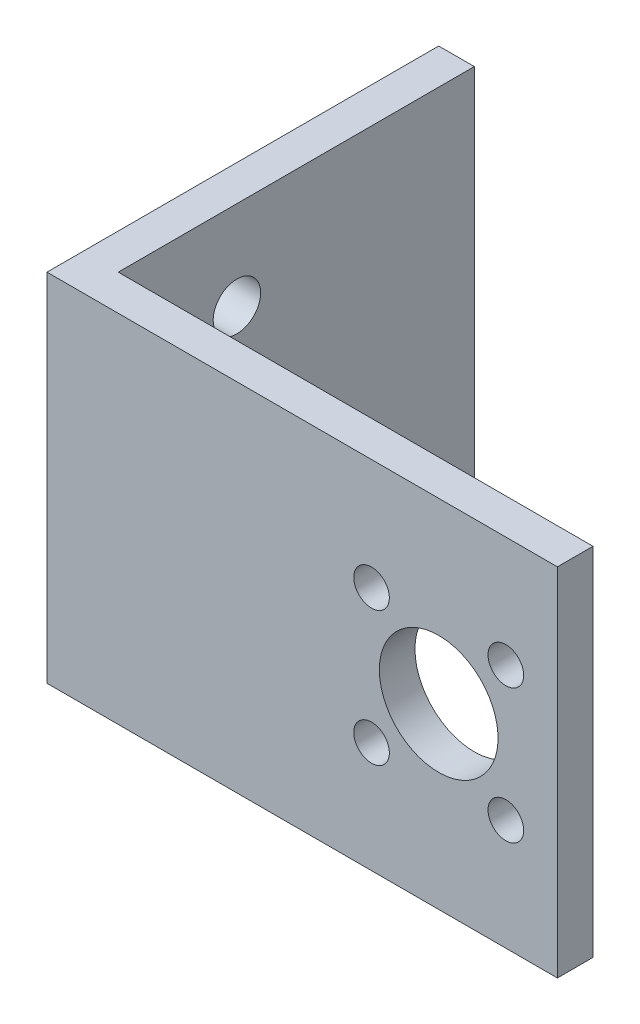
from build123d import *

# Parameters (mm, degrees)
EXTRUDE_1_DEPTH     = 30
CUT_EXTRUDE_1_REACH = 63.952
SKETCH_4_R          = 2
CUT_EXTRUDE_2_REACH = 62.407
SKETCH_5_R          = 5
SKETCH_5_R_2        = 1.5


with BuildPart() as part:
    # 草图2 → 凸台-拉伸1 (new body)
    with BuildSketch(Plane(origin=(0, 0, 0), x_dir=(1, 0, 0), z_dir=(0, 1, 0))):
        Polygon((0, 0), (43, 0), (43, 3), (3, 3), (3, 33), (0, 33), align=None)
    extrude(amount=EXTRUDE_1_DEPTH)

    # 草图4 → 切除-拉伸1 (cut, up to next)
    with BuildSketch(Plane.ZY, mode=Mode.PRIVATE) as cut_extrude_1_sk1:
        with Locations((-13, 7.5)):
            Circle(SKETCH_4_R)
    cut_extrude_1_tool1 = extrude(cut_extrude_1_sk1.sketch, amount=-CUT_EXTRUDE_1_REACH, mode=Mode.PRIVATE) & part.part
    # 草图4 → 切除-拉伸1 (cut, up to next)
    with BuildSketch(Plane.ZY, mode=Mode.PRIVATE) as cut_extrude_1_sk2:
        with Locations((-13, 22.5)):
            Circle(SKETCH_4_R)
    cut_extrude_1_tool2 = extrude(cut_extrude_1_sk2.sketch, amount=-CUT_EXTRUDE_1_REACH, mode=Mode.PRIVATE) & part.part
    add(cut_extrude_1_tool1.solids().sort_by_distance((0, 7.5, -13))[0], mode=Mode.SUBTRACT)
    add(cut_extrude_1_tool2.solids().sort_by_distance((0, 22.5, -13))[0], mode=Mode.SUBTRACT)

    # 草图5 → 切除-拉伸2 (cut, up to next)
    with BuildSketch(Plane(origin=(0, 0, -3), x_dir=(-1, 0, 0), z_dir=(0, 0, -1)), mode=Mode.PRIVATE) as cut_extrude_2_sk1:
        with Locations((-33, 15)):
            Circle(SKETCH_5_R)
    cut_extrude_2_tool1 = extrude(cut_extrude_2_sk1.sketch, amount=-CUT_EXTRUDE_2_REACH, mode=Mode.PRIVATE) & part.part
    # 草图5 → 切除-拉伸2 (cut, up to next)
    with BuildSketch(Plane(origin=(0, 0, -3), x_dir=(-1, 0, 0), z_dir=(0, 0, -1)), mode=Mode.PRIVATE) as cut_extrude_2_sk2:
        with Locations((-38.656854249, 9.343145751)):
            Circle(SKETCH_5_R_2)
    cut_extrude_2_tool2 = extrude(cut_extrude_2_sk2.sketch, amount=-CUT_EXTRUDE_2_REACH, mode=Mode.PRIVATE) & part.part
    # 草图5 → 切除-拉伸2 (cut, up to next)
    with BuildSketch(Plane(origin=(0, 0, -3), x_dir=(-1, 0, 0), z_dir=(0, 0, -1)), mode=Mode.PRIVATE) as cut_extrude_2_sk3:
        with Locations((-27.343145751, 9.343145751)):
            Circle(SKETCH_5_R_2)
    cut_extrude_2_tool3 = extrude(cut_extrude_2_sk3.sketch, amount=-CUT_EXTRUDE_2_REACH, mode=Mode.PRIVATE) & part.part
    # 草图5 → 切除-拉伸2 (cut, up to next)
    with BuildSketch(Plane(origin=(0, 0, -3), x_dir=(-1, 0, 0), z_dir=(0, 0, -1)), mode=Mode.PRIVATE) as cut_extrude_2_sk4:
        with Locations((-38.656854249, 20.656854249)):
            Circle(SKETCH_5_R_2)
    cut_extrude_2_tool4 = extrude(cut_extrude_2_sk4.sketch, amount=-CUT_EXTRUDE_2_REACH, mode=Mode.PRIVATE) & part.part
    # 草图5 → 切除-拉伸2 (cut, up to next)
    with BuildSketch(Plane(origin=(0, 0, -3), x_dir=(-1, 0, 0), z_dir=(0, 0, -1)), mode=Mode.PRIVATE) as cut_extrude_2_sk5:
        with Locations((-27.343145751, 20.656854249)):
            Circle(SKETCH_5_R_2)
    cut_extrude_2_tool5 = extrude(cut_extrude_2_sk5.sketch, amount=-CUT_EXTRUDE_2_REACH, mode=Mode.PRIVATE) & part.part
    add(cut_extrude_2_tool1.solids().sort_by_distance((33, 15, -3))[0], mode=Mode.SUBTRACT)
    add(cut_extrude_2_tool2.solids().sort_by_distance((38.656854, 9.343146, -3))[0], mode=Mode.SUBTRACT)
    add(cut_extrude_2_tool3.solids().sort_by_distance((27.343146, 9.343146, -3))[0], mode=Mode.SUBTRACT)
    add(cut_extrude_2_tool4.solids().sort_by_distance((38.656854, 20.656854, -3))[0], mode=Mode.SUBTRACT)
    add(cut_extrude_2_tool5.solids().sort_by_distance((27.343146, 20.656854, -3))[0], mode=Mode.SUBTRACT)


solid = part.part
